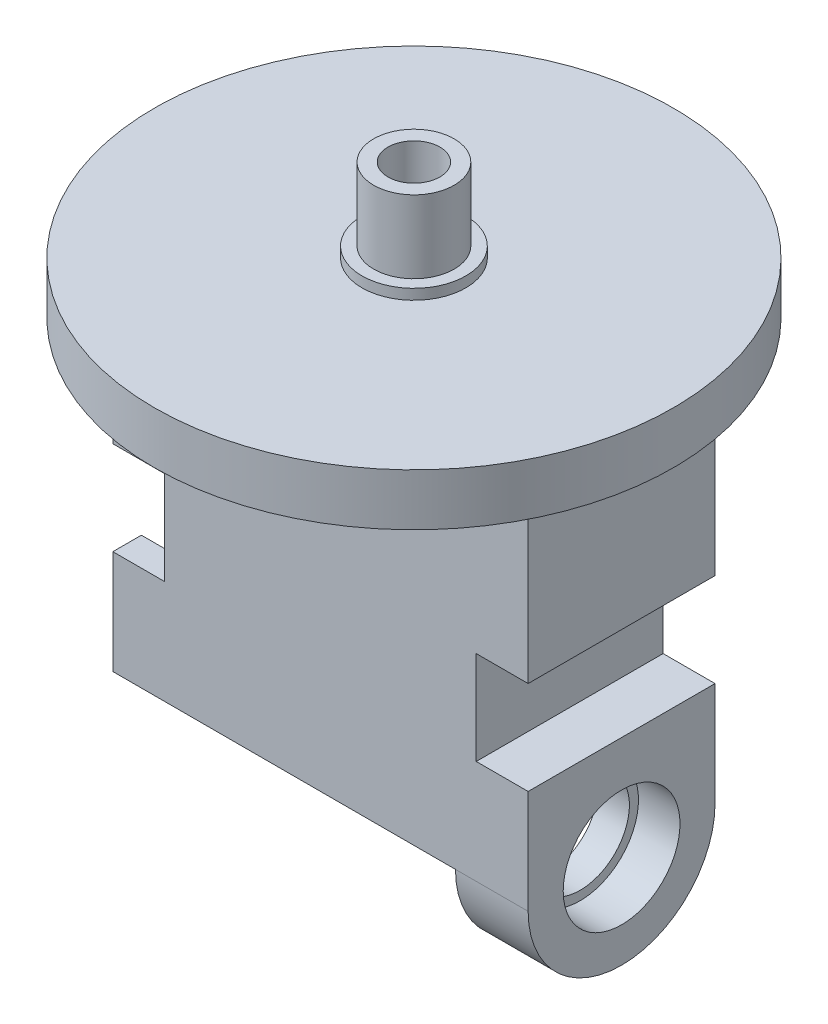
from build123d import *

# Parameters (mm, degrees)
SKETCH1_R           = 25
BOSS_EXTRUDE1_DEPTH = 5
SKETCH8_R           = 4.75
BOSS_EXTRUDE3_DEPTH = 7
SKETCH9_R           = 5.625
CUT_EXTRUDE3_DEPTH  = 4
SKETCH11_W          = 33
SKETCH11_H          = 18
BOSS_EXTRUDE4_DEPTH = 35
SKETCH12_W          = 12.5
SKETCH12_H          = 18
CUT_EXTRUDE4_DEPTH  = 28
SKETCH13_W          = 12.5
SKETCH13_H          = 6
CUT_EXTRUDE6_DEPTH  = 10.79
CUT_EXTRUDE8_DEPTH  = 5
SKETCH16_R          = 5
BOSS_EXTRUDE5_DEPTH = 1
SKETCH17_R          = 3.875
BOSS_EXTRUDE6_DEPTH = 7
SKETCH18_R          = 2.5
CUT_EXTRUDE9_DEPTH  = 6
SKETCH14_R          = 3
CUT_EXTRUDE7_DEPTH  = 7


with BuildPart() as part:
    # Sketch1 → Boss-Extrude1 (new body)
    with BuildSketch(Plane(origin=(0, 0, 0), x_dir=(1, 0, 0), z_dir=(0, 1, 0))):
        with Locations(Location((0, 0, 0), (0, 0, 270))):
            Circle(SKETCH1_R)
    extrude(amount=BOSS_EXTRUDE1_DEPTH)

    # Sketch8 → Boss-Extrude3 (add)
    with BuildSketch(Plane(origin=(20, 0, 0), x_dir=(0, 0, -1), z_dir=(1, 0, 0))):
        with BuildLine():
            Line((-9, 0), (-9, -35))
            ThreePointArc((-9, -35), (0, -44), (9, -35))
            Line((9, -35), (9, 0))
            Line((9, 0), (-9, 0))
        make_face()
        with Locations((0, -35)):
            Circle(SKETCH8_R, mode=Mode.SUBTRACT)
    extrude(amount=-BOSS_EXTRUDE3_DEPTH)

    # Sketch9 → Cut-Extrude3 (cut)
    with BuildSketch(Plane.ZY.offset(-20)):
        with Locations((0, -35)):
            Circle(SKETCH9_R)
    extrude(amount=CUT_EXTRUDE3_DEPTH, mode=Mode.SUBTRACT)

    # Sketch11 → Boss-Extrude4 (add)
    with BuildSketch(Plane(origin=(0, 0, 0), x_dir=(-1, 0, 0), z_dir=(0, -1, 0))):
        with Locations((3.5, 0)):
            Rectangle(SKETCH11_W, SKETCH11_H)
    extrude(amount=BOSS_EXTRUDE4_DEPTH)

    # Sketch12 → Cut-Extrude4 (cut)
    with BuildSketch(Plane.ZY.offset(20)):
        with Locations((0, -26)):
            Rectangle(SKETCH12_W, SKETCH12_H)
    extrude(amount=-CUT_EXTRUDE4_DEPTH, mode=Mode.SUBTRACT)

    # Sketch13 → Cut-Extrude6 (cut)
    with BuildSketch(Plane.ZY.offset(20)):
        with Locations((0, -14)):
            Rectangle(SKETCH13_W, SKETCH13_H)
    extrude(amount=-CUT_EXTRUDE6_DEPTH, mode=Mode.SUBTRACT)

    # Sketch15 → Cut-Extrude8 (cut)
    with BuildSketch(Plane.ZY.offset(20)):
        Polygon((-6.25, -25), (-9, -25), (-9, -16), (-6.25, -16), (9, -16), (9, -25), align=None)
    cut_extrude8 = extrude(amount=-CUT_EXTRUDE8_DEPTH, mode=Mode.SUBTRACT)

    # Mirror1: Cut-Extrude8 across plane
    add(cut_extrude8.mirror(Plane.ZY), mode=Mode.SUBTRACT)

    # Sketch16 → Boss-Extrude5 (add)
    with BuildSketch(Plane(origin=(0, 5, 0), x_dir=(1, 0, 0), z_dir=(0, 1, 0))):
        with Locations(Location((0, 0, 0), (0, 0, 270))):
            Circle(SKETCH16_R)
    extrude(amount=BOSS_EXTRUDE5_DEPTH)

    # Sketch17 → Boss-Extrude6 (add)
    with BuildSketch(Plane(origin=(0, 6, 0), x_dir=(1, 0, 0), z_dir=(0, 1, 0))):
        with Locations(Location((0, 0, 0), (0, 0, 270))):
            Circle(SKETCH17_R)
    extrude(amount=BOSS_EXTRUDE6_DEPTH)

    # Sketch18 → Cut-Extrude9 (cut)
    with BuildSketch(Plane(origin=(0, 13, 0), x_dir=(1, 0, 0), z_dir=(0, 1, 0))):
        with Locations(Location((0, 0, 0), (0, 0, 270))):
            Circle(SKETCH18_R)
    extrude(amount=-CUT_EXTRUDE9_DEPTH, mode=Mode.SUBTRACT)

    # Sketch14 → Cut-Extrude7 (cut)
    with BuildSketch(Plane(origin=(0, 5, 0), x_dir=(1, 0, 0), z_dir=(0, 1, 0))):
        with Locations(Location((0, 0, 0), (0, 0, 270))):
            Circle(SKETCH14_R)
    extrude(amount=-CUT_EXTRUDE7_DEPTH, mode=Mode.SUBTRACT)


solid = part.part
